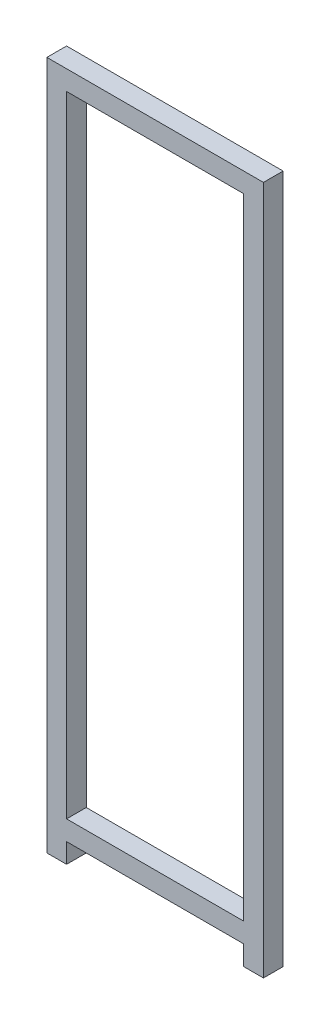
from build123d import *

# Parameters (mm, degrees)
CROQUIS1_W              = 450
CROQUIS1_H              = 1600
SALIENTE_EXTRUIR1_DEPTH = 50


with BuildPart() as part:
    # Croquis1 → Saliente-Extruir1 (new body)
    with BuildSketch(Plane.XY):
        Polygon((-275, -1500), (-275, 250), (275, 250), (275, -1500), (225, -1500), (225, -1450), (-225, -1450), (-225, -1500), align=None)
        with Locations((0, -600)):
            Rectangle(CROQUIS1_W, CROQUIS1_H, mode=Mode.SUBTRACT)
    extrude(amount=-SALIENTE_EXTRUIR1_DEPTH)


solid = part.part
